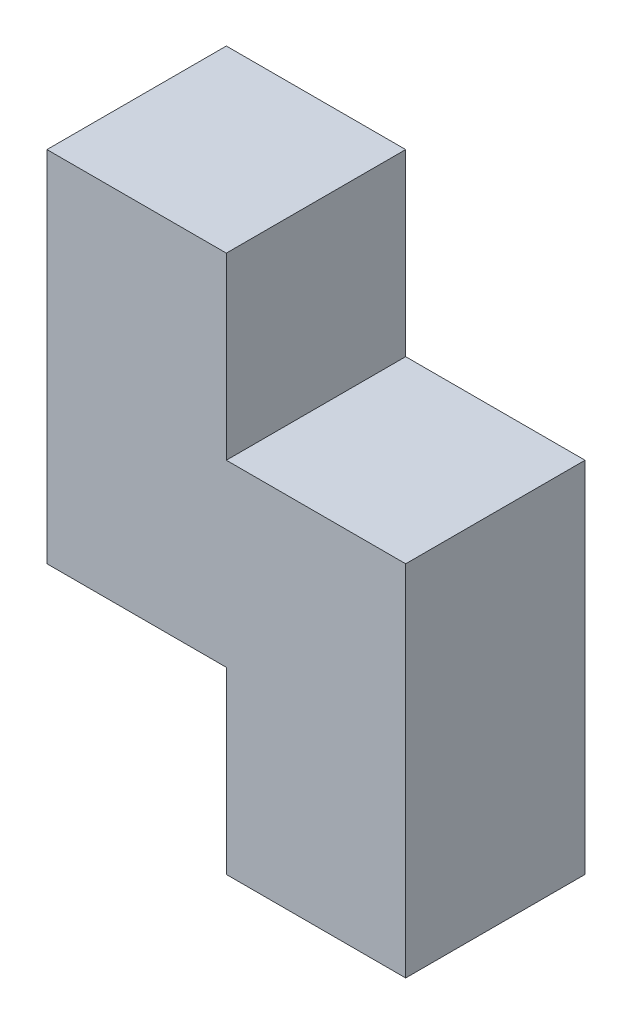
from build123d import *

# Parameters (mm, degrees)
BOSS_EXTRUDE1_DEPTH = 30


with BuildPart() as part:
    # Sketch1 → Boss-Extrude1 (new body)
    with BuildSketch(Plane.XY):
        Polygon((19.888680701, 30), (-10.111319299, 30), (-10.111319299, -30), (19.888680701, -30), (19.888680701, -60), (49.888680701, -60), (49.888680701, 0), (19.888680701, 0), align=None)
    extrude(amount=BOSS_EXTRUDE1_DEPTH)


solid = part.part
